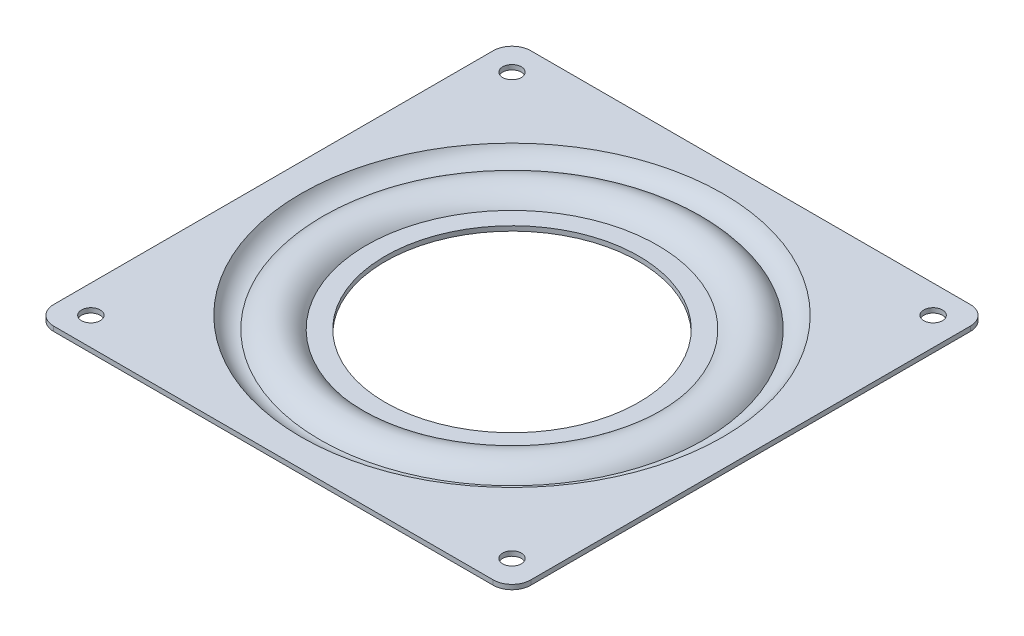
from build123d import *

# Parameters (mm, degrees)
SKETCH_2_R      = 1.985
SKETCH_2_R_2    = 44.910539349
EXTRUDE_1_DEPTH = 1


with BuildPart() as part:
    # 草图1 → 旋转1 (revolve)
    with BuildSketch(Plane.XY, mode=Mode.PRIVATE) as revolve_1_sk:
        with BuildLine():
            ThreePointArc((-45.813874016, -0.428936451), (-43.539426354, -2.86488143), (-40.275857757, -3.540203663))
            ThreePointArc((-40.275857757, -3.540203663), (-35.905809817, -1.000028754), (-31.553091654, -3.569785971))
            Line((-31.553091654, -3.569785971), (-27, -3.569785971))
            Line((-27, -3.569785971), (-27, -2.569785971))
            Line((-27, -2.569785971), (-31, -2.569785971))
            ThreePointArc((-31, -2.569785971), (-35.922766673, 0), (-40.845533346, -2.569785971))
            ThreePointArc((-40.845533346, -2.569785971), (-43.250116145, -1.873465974), (-44.910539349, 0))
            Line((-44.910539349, 0), (-45.813874016, -0.428936451))
        make_face()
    revolve(revolve_1_sk.sketch.rotate(Axis((0, 6.917160425, 0), (0, -1, 0)), 270), axis=Axis((0, 6.917160425, 0), (0, -1, 0)))

    # 草图2 → 凸台-拉伸1 (add)
    with BuildSketch(Plane(origin=(0, 0, 0), x_dir=(1, 0, 0), z_dir=(0, 1, 0))):
        with BuildLine():
            Line((46.8, 50.8), (-46.8, 50.8))
            ThreePointArc((-46.8, 50.8), (-49.628427125, 49.628427125), (-50.8, 46.8))
            Line((-50.8, 46.8), (-50.8, -46.8))
            ThreePointArc((-50.8, -46.8), (-49.628427125, -49.628427125), (-46.8, -50.8))
            Line((-46.8, -50.8), (46.8, -50.8))
            ThreePointArc((46.8, -50.8), (49.628427125, -49.628427125), (50.8, -46.8))
            Line((50.8, -46.8), (50.8, 46.8))
            ThreePointArc((50.8, 46.8), (49.628427125, 49.628427125), (46.8, 50.8))
        make_face()
        with Locations(Location((-44.845, -44.845, 0), (0, 0, 270))):
            Circle(SKETCH_2_R, mode=Mode.SUBTRACT)
        with Locations(Location((44.845, -44.845, 0), (0, 0, 270))):
            Circle(SKETCH_2_R, mode=Mode.SUBTRACT)
        Circle(SKETCH_2_R_2, mode=Mode.SUBTRACT)
        with Locations(Location((-44.845, 44.845, 0), (0, 0, 270))):
            Circle(SKETCH_2_R, mode=Mode.SUBTRACT)
        with Locations(Location((44.845, 44.845, 0), (0, 0, 270))):
            Circle(SKETCH_2_R, mode=Mode.SUBTRACT)
    extrude(amount=-EXTRUDE_1_DEPTH)


solid = part.part
